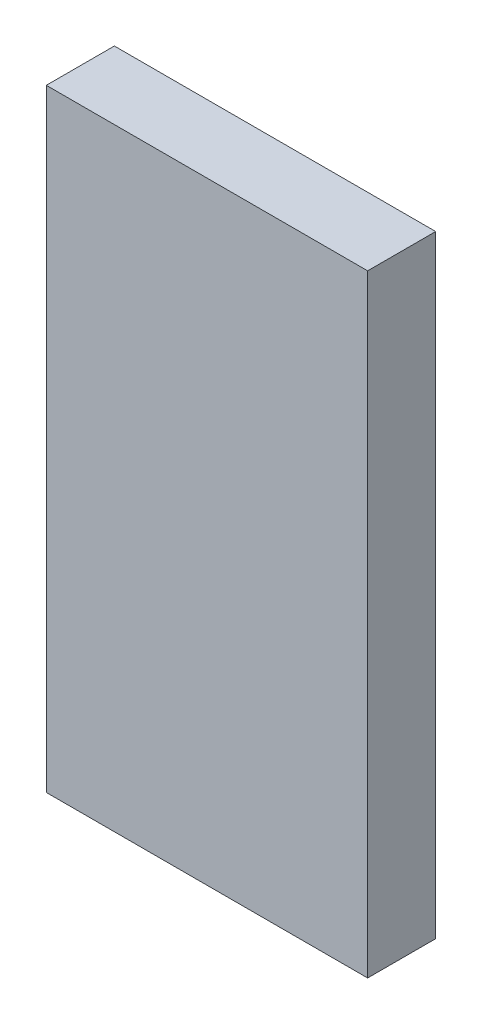
from build123d import *

# Parameters (mm, degrees)
SKETCH_1_W      = 85
SKETCH_1_H      = 162
EXTRUDE_1_DEPTH = 18


with BuildPart() as part:
    # Эскиз1 → Бобышка-Вытянуть1 (new body)
    with BuildSketch(Plane.XY):
        with Locations((42.5, 81)):
            Rectangle(SKETCH_1_W, SKETCH_1_H)
    extrude(amount=EXTRUDE_1_DEPTH)


solid = part.part
